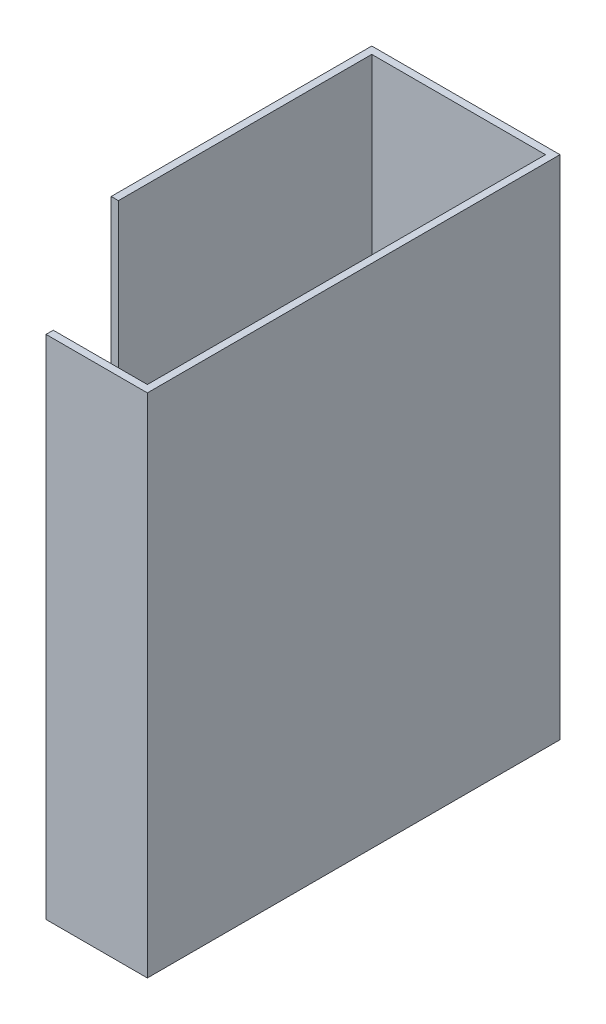
from build123d import *

# Parameters (mm, degrees)
BOSS_EXTRUDE1_DEPTH = 700


with BuildPart() as part:
    # Sketch1 → Boss-Extrude1 (new body)
    with BuildSketch(Plane(origin=(0, 0, 0), x_dir=(1, 0, 0), z_dir=(0, 1, 0))):
        Polygon((0, 0), (0, 570), (-260, 570), (-260, 210), (-250, 210), (-250, 560), (-10, 560), (-10, 10), (-140, 10), (-140, 0), align=None)
    extrude(amount=BOSS_EXTRUDE1_DEPTH)


solid = part.part
